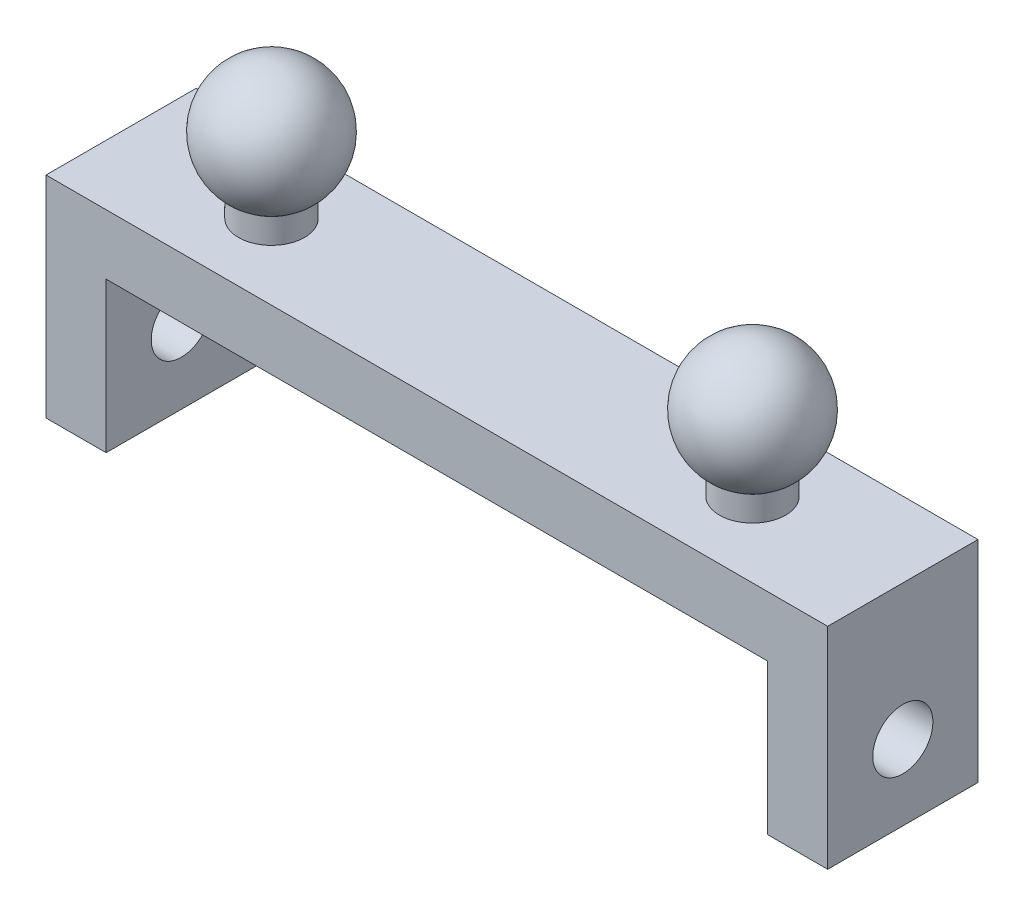
from build123d import *

# Parameters (mm, degrees)
EXTRUDE_1_DEPTH     = 2.5
SKETCH_2_R          = 1
CUT_EXTRUDE_1_DEPTH = 28.041634566


with BuildPart() as part:
    # 草图1 → 凸台-拉伸1 (new, symmetric)
    with BuildSketch(Plane.XY):
        Polygon((0, 0), (13, 0), (13, -7), (11, -7), (11, -2), (0, -2), align=None)
    extrude_1 = extrude(amount=EXTRUDE_1_DEPTH, both=True)

    # 镜向1: 凸台-拉伸1 across plane
    add(extrude_1.mirror(Plane(origin=(0, 0, 0), x_dir=(0, 0, 1), z_dir=(1, 0, 0))))

    # 草图2 → 切除-拉伸1 (cut, through all)
    with BuildSketch(Plane(origin=(13, 0, 0), x_dir=(0, 0, -1), z_dir=(1, 0, 0))):
        with Locations((0, -4.5)):
            Circle(SKETCH_2_R)
    extrude(amount=-CUT_EXTRUDE_1_DEPTH, mode=Mode.SUBTRACT)

    # 草图3 → 旋转1 (revolve)
    with BuildSketch(Plane(origin=(8, 0, 0), x_dir=(0, 0, -1), z_dir=(1, 0, 0))):
        with BuildLine():
            Line((0, 0), (0, 4.5))
            ThreePointArc((0, 4.5), (1.915810353, 3.074169567), (1.1, 0.829670691))
            Line((1.1, 0.829670691), (1.1, 0))
            Line((1.1, 0), (0, 0))
        make_face()
    revolve(axis=Axis((8, 0, 0), (0, 1, 0)))

    # 草图4 → 旋转2 (revolve)
    with BuildSketch(Plane.ZY.offset(8), mode=Mode.PRIVATE) as revolve_2_sk:
        with BuildLine():
            Line((0, 0), (0, 4.5))
            ThreePointArc((0, 4.5), (1.915810353, 3.074169567), (1.1, 0.829670691))
            Line((1.1, 0.829670691), (1.1, 0))
            Line((1.1, 0), (0, 0))
        make_face()
    revolve(revolve_2_sk.sketch.rotate(Axis((-8, 0, 0), (0, 1, 0)), 180), axis=Axis((-8, 0, 0), (0, 1, 0)))


solid = part.part
